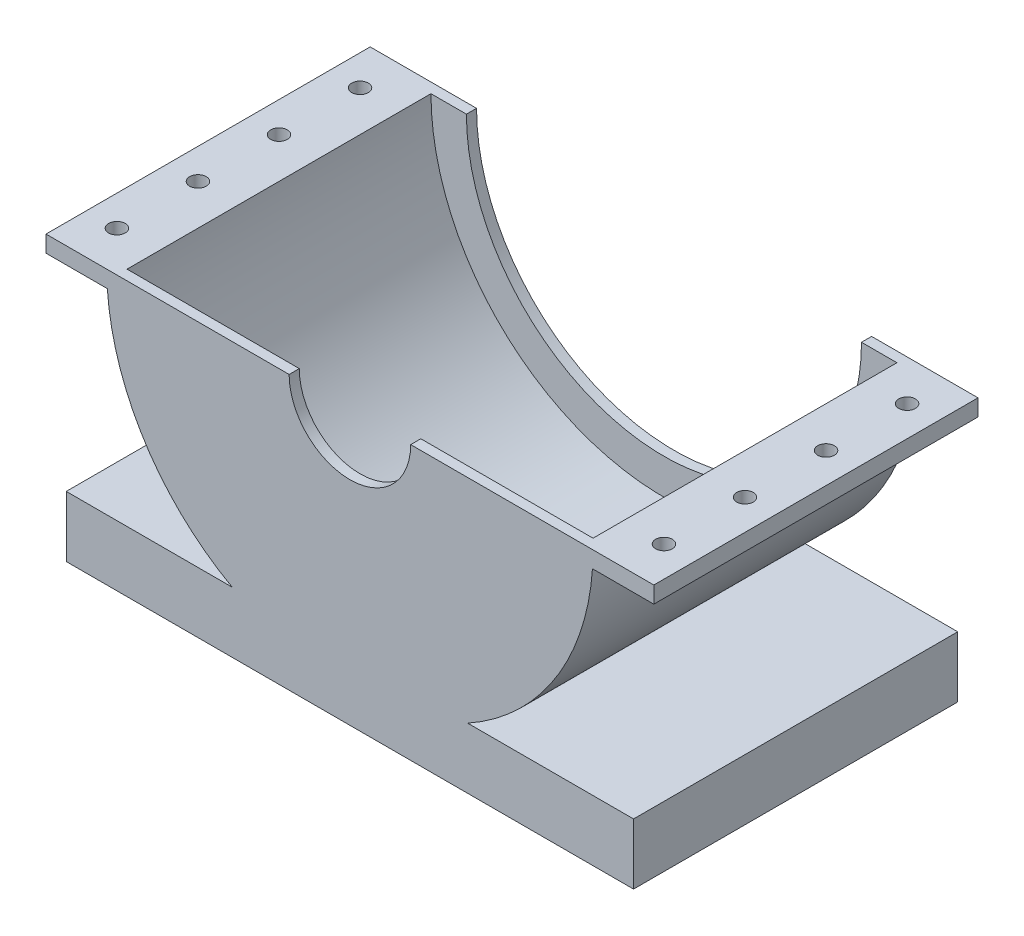
from build123d import *

# Parameters (mm, degrees)
BOSS_EXTRUDE1_DEPTH      = 80
BOSS_EXTRUDE2_DEPTH      = 80
BOSS_EXTRUDE3_DEPTH      = 2.5
BOSS_EXTRUDE6_START      = -2.5
BOSS_EXTRUDE6_DEPTH      = 2.5
BOSS_EXTRUDE7_REACH      = 202.922
BOSS_EXTRUDE7_END_RADIUS = 60
BOSS_EXTRUDE7_START      = 75
SKETCH10_W               = 80
SKETCH10_H               = 4.1
SKETCH11_R               = 2.05
CUT_EXTRUDE3_DEPTH       = 4.1


with BuildPart() as part:
    # Sketch1 → Boss-Extrude1 (new body)
    with BuildSketch(Plane.XY):
        with BuildLine():
            Line((29.047375097, 15), (70, 15))
            Line((70, 15), (70, 0))
            Line((70, 0), (-70, 0))
            Line((-70, 0), (-70, 15))
            Line((-70, 15), (-29.047375097, 15))
            ThreePointArc((-29.047375097, 15), (0, 7.5), (29.047375097, 15))
        make_face()
    extrude(amount=BOSS_EXTRUDE1_DEPTH)

    # Sketch2 → Boss-Extrude2 (add)
    with BuildSketch(Plane(origin=(0, 0, 0), x_dir=(-1, 0, 0), z_dir=(0, 0, -1))):
        with BuildLine():
            Line((-60, 67.5), (-57.5, 67.5))
            ThreePointArc((-57.5, 67.5), (0, 10), (57.5, 67.5))
            Line((57.5, 67.5), (60, 67.5))
            ThreePointArc((60, 67.5), (0, 7.5), (-60, 67.5))
        make_face()
    extrude(amount=-BOSS_EXTRUDE2_DEPTH)

    # Sketch3 → Boss-Extrude3 (add)
    with BuildSketch(Plane(origin=(0, 0, 0), x_dir=(-1, 0, 0), z_dir=(0, 0, -1))):
        with BuildLine():
            Line((-57.5, 67.5), (-48.75, 67.5))
            ThreePointArc((-48.75, 67.5), (0, 18.75), (48.75, 67.5))
            Line((48.75, 67.5), (57.5, 67.5))
            ThreePointArc((57.5, 67.5), (0, 10), (-57.5, 67.5))
        make_face()
    extrude(amount=-BOSS_EXTRUDE3_DEPTH)

    # Sketch9 → Boss-Extrude6 (add)
    with BuildSketch(Plane.XY.offset(80).offset(BOSS_EXTRUDE6_START)):
        with BuildLine():
            Line((-57.5, 67.5), (-15, 67.5))
            ThreePointArc((-15, 67.5), (0, 52.5), (15, 67.5))
            Line((15, 67.5), (57.5, 67.5))
            ThreePointArc((57.5, 67.5), (0, 10), (-57.5, 67.5))
        make_face()
    extrude(amount=BOSS_EXTRUDE6_DEPTH)

    # Boss-Extrude7: up to this cylinder (the profile starts outside it)
    boss_extrude7_end = Plane(origin=(0, 67.5, 40), z_dir=(0, 0, -1)) * Cylinder(BOSS_EXTRUDE7_END_RADIUS, 526.844, mode=Mode.PRIVATE)
    # Sketch10 → Boss-Extrude7 (add, up to the surface)
    with BuildSketch(Plane(origin=(0, 0, 0), x_dir=(0, 0, -1), z_dir=(1, 0, 0)).offset(BOSS_EXTRUDE7_START), mode=Mode.PRIVATE) as boss_extrude7_sk1:
        with Locations((-40, 65.45)):
            Rectangle(SKETCH10_W, SKETCH10_H)
    boss_extrude7_tool1 = extrude(boss_extrude7_sk1.sketch, amount=-BOSS_EXTRUDE7_REACH, mode=Mode.PRIVATE) - boss_extrude7_end
    boss_extrude7 = boss_extrude7_tool1.solids().sort_by_distance((75, 65.45, 40))[0]
    add(boss_extrude7)

    # Sketch11 → Cut-Extrude3 (cut)
    with BuildSketch(Plane(origin=(0, 67.5, 0), x_dir=(1, 0, 0), z_dir=(0, 1, 0))):
        with Locations((67.5, -70)):
            Circle(SKETCH11_R)
        with Locations((67.5, -50)):
            Circle(SKETCH11_R)
        with Locations((67.5, -30)):
            Circle(SKETCH11_R)
        with Locations((67.5, -10)):
            Circle(SKETCH11_R)
    cut_extrude3 = extrude(amount=-CUT_EXTRUDE3_DEPTH, mode=Mode.SUBTRACT)

    # Mirror3: Boss-Extrude7, Cut-Extrude3 across plane
    add(boss_extrude7.mirror(Plane(origin=(0, 0, 0), x_dir=(0, 0, 1), z_dir=(1, 0, 0))))
    add(cut_extrude3.mirror(Plane(origin=(0, 0, 0), x_dir=(0, 0, 1), z_dir=(1, 0, 0))), mode=Mode.SUBTRACT)


solid = part.part
